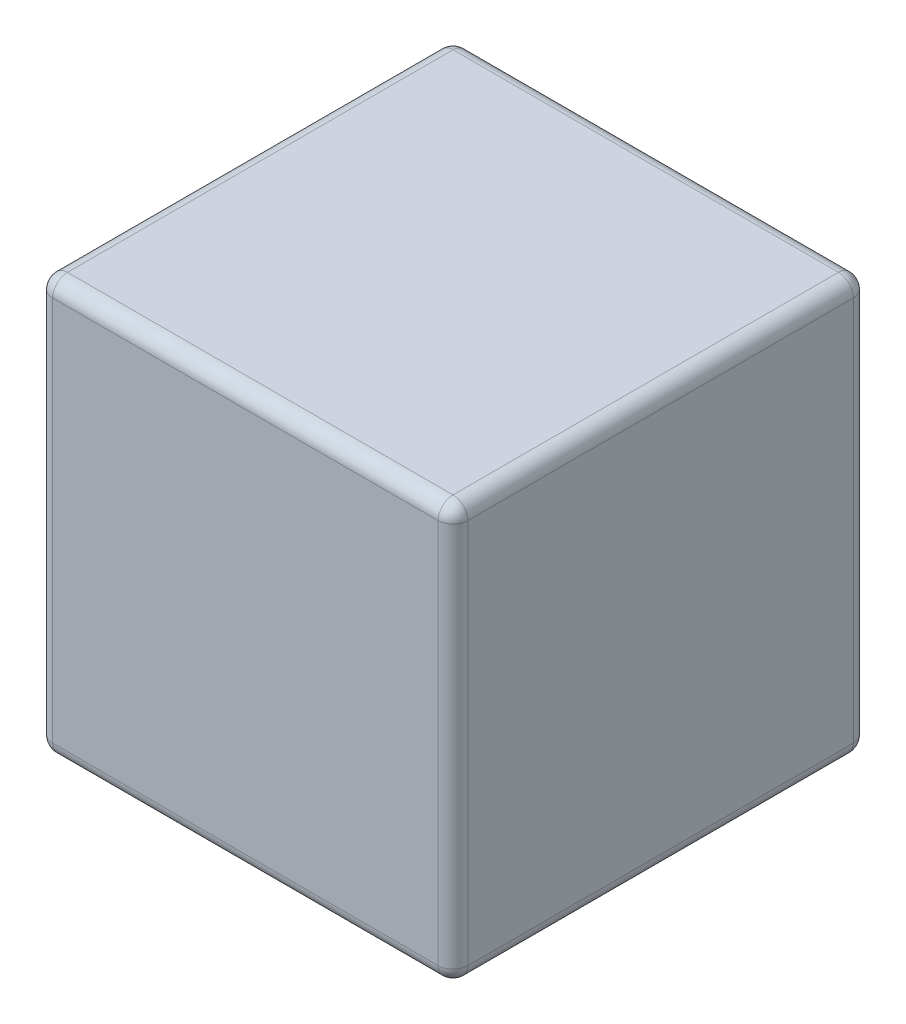
from build123d import *

# Parameters (mm, degrees)
SKETCH1_W           = 56
SKETCH1_H           = 56
BOSS_EXTRUDE1_DEPTH = 28
FILLET1_R           = 2


with BuildPart() as part:
    # Sketch1 → Boss-Extrude1 (new, symmetric)
    with BuildSketch(Plane(origin=(0, 0, 0), x_dir=(1, 0, 0), z_dir=(0, 1, 0))):
        Rectangle(SKETCH1_W, SKETCH1_H)
    extrude(amount=BOSS_EXTRUDE1_DEPTH, both=True)

    # Fillet1
    fillet1_edges = [part.edges().sort_by_distance(p)[0] for p in [
        (-28, 28, 0),
        (0, 28, 28),
        (28, 28, 0),
        (0, -28, 28),
        (-28, -28, 0),
        (0, -28, -28),
        (28, -28, 0),
        (28, 0, 28),
        (-28, 0, 28),
        (-28, 0, -28),
        (28, 0, -28),
        (0, 28, -28),
    ]]
    fillet(fillet1_edges, radius=FILLET1_R)


solid = part.part
